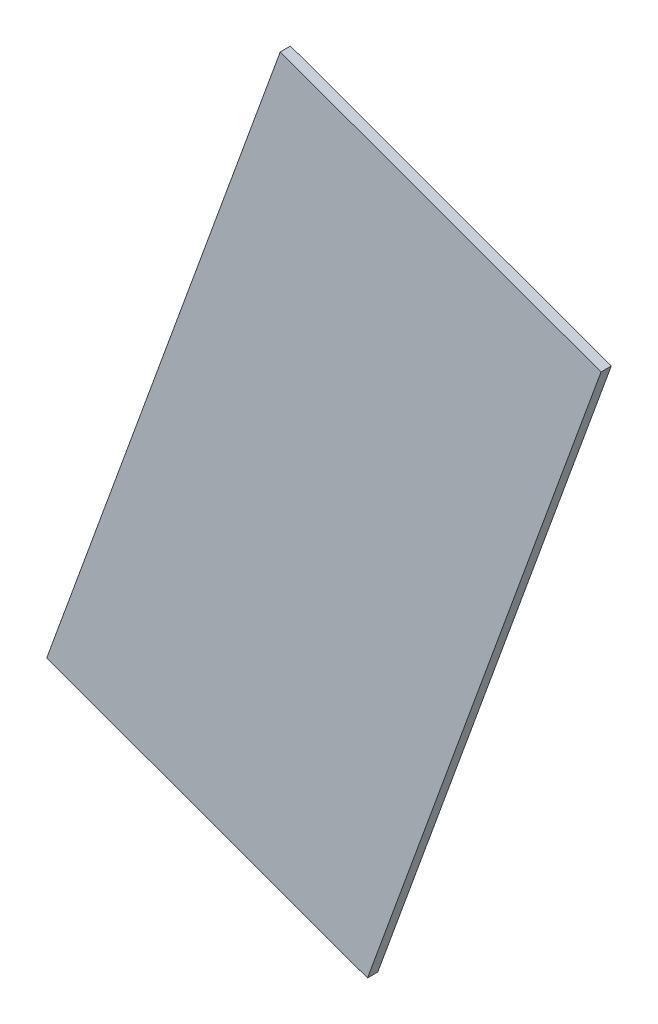
from build123d import *

# Parameters (mm, degrees)
EXTRUDE_1_DEPTH = 3


with BuildPart() as part:
    # 草图1 → 凸台-拉伸1 (new body)
    with BuildSketch(Plane.XY):
        Polygon((413.792962611, 649.964583032), (482.196991276, 837.903107189), (388.227729197, 872.105121522), (319.823700532, 684.166597365), align=None)
    extrude(amount=EXTRUDE_1_DEPTH)


solid = part.part
